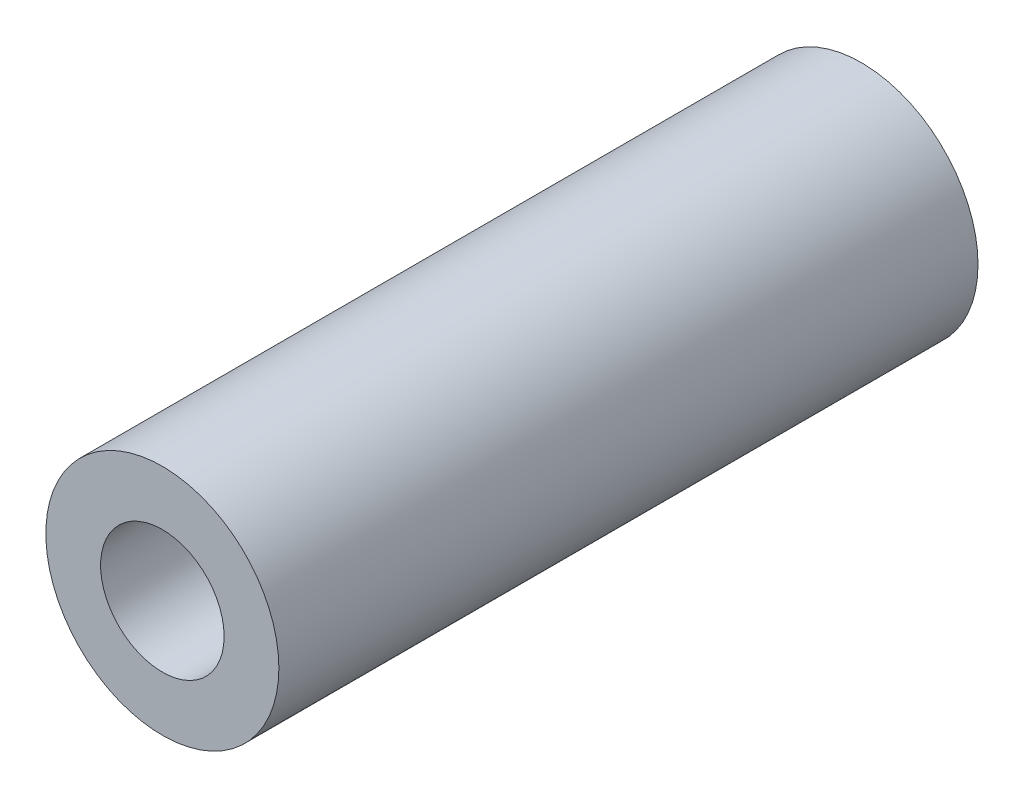
from build123d import *

# Parameters (mm, degrees)
SKETCH1_R      = 5
SKETCH1_R_2    = 2.65
EXTRUDE1_DEPTH = 15


with BuildPart() as part:
    # Sketch1 → Extrude1 (new, symmetric)
    with BuildSketch(Plane.XY):
        Circle(SKETCH1_R)
        Circle(SKETCH1_R_2, mode=Mode.SUBTRACT)
    extrude(amount=EXTRUDE1_DEPTH, both=True)


solid = part.part
